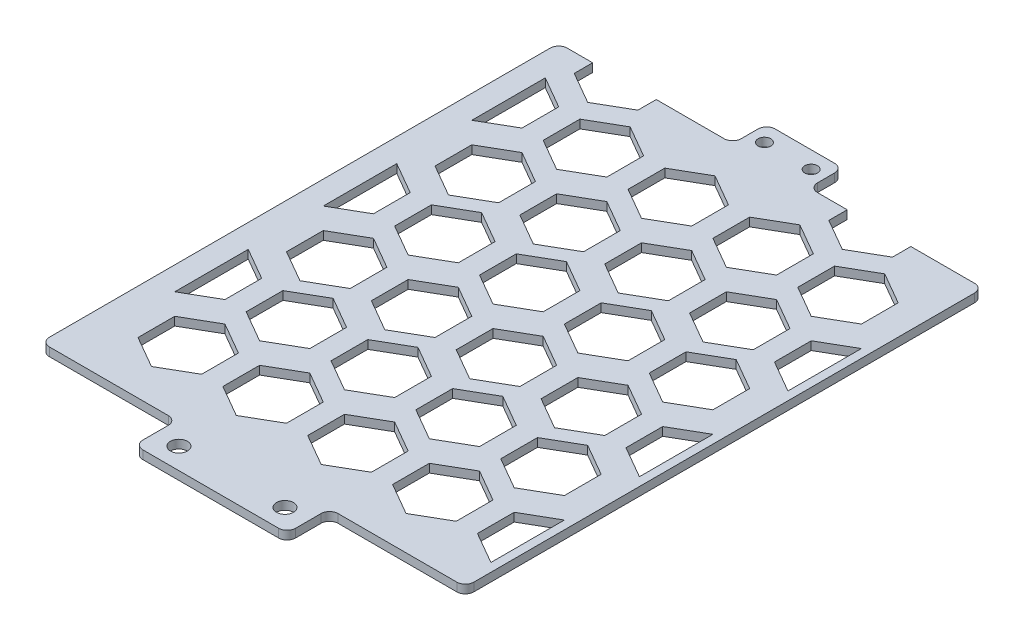
from build123d import *

# Parameters (mm, degrees)
SKETCH_1_R          = 1.5
SKETCH_1_R_2        = 2
EXTRUDE_1_DEPTH     = 2
SKETCH_4_R          = 1.5
CUT_EXTRUDE_3_DEPTH = 10
CUT_EXTRUDE_4_DEPTH = 3
CUT_EXTRUDE_5_DEPTH = 3
FILLET_3_R          = 2


with BuildPart() as part:
    # 草图1 → 凸台-拉伸1 (new body)
    with BuildSketch(Plane(origin=(0, 0, 0), x_dir=(1, 0, 0), z_dir=(0, 1, 0))):
        Polygon((50, -70), (18, -70), (18, -80), (-18, -80), (-18, -70), (-50, -70), (-50, 70), (50, 70), align=None)
        with Locations(Location((-42.5, 66, 0), (0, 0, 270))):
            Circle(SKETCH_1_R, mode=Mode.SUBTRACT)
        with Locations(Location((42.5, 66, 0), (0, 0, 270))):
            Circle(SKETCH_1_R, mode=Mode.SUBTRACT)
        with Locations(Location((-12.5, -75, 0), (0, 0, 270))):
            Circle(SKETCH_1_R_2, mode=Mode.SUBTRACT)
        with Locations(Location((12.5, -75, 0), (0, 0, 270))):
            Circle(SKETCH_1_R_2, mode=Mode.SUBTRACT)
    extrude(amount=EXTRUDE_1_DEPTH)

    # 草图4 → 切除-拉伸3 (cut)
    with BuildSketch(Plane(origin=(0, 2, 0), x_dir=(1, 0, 0), z_dir=(0, 1, 0))):
        with Locations(Location((-5.5, 56, 0), (0, 0, 270))):
            Circle(SKETCH_4_R)
        with Locations(Location((5.5, 56, 0), (0, 0, 270))):
            Circle(SKETCH_4_R)
        Polygon((-50, 70), (50, 70), (50, 52), (9, 52), (9, 60), (-9, 60), (-9, 52), (-50, 52), align=None)
    extrude(amount=-CUT_EXTRUDE_3_DEPTH, mode=Mode.SUBTRACT)

    # 草图5 → 切除-拉伸4 (cut)
    with BuildSketch(Plane(origin=(0, 2, 0), x_dir=(1, 0, 0), z_dir=(0, 1, 0))):
        Polygon((-34.5, 43.339745962), (-27, 47.669872981), (-27, 56.330127019), (-34.5, 60.660254038), (-42, 56.330127019), (-42, 47.669872981), align=None)
        Polygon((25.5, 43.339745962), (33, 47.669872981), (33, 56.330127019), (25.5, 60.660254038), (18, 56.330127019), (18, 47.669872981), align=None)
    extrude(amount=-CUT_EXTRUDE_4_DEPTH, mode=Mode.SUBTRACT)

    # 草图7 → 切除-拉伸5 (cut)
    with BuildSketch(Plane(origin=(0, 2, 0), x_dir=(1, 0, 0), z_dir=(0, 1, 0))):
        Polygon((-24.5, 43.339745962), (-32, 39.009618943), (-32, 30.349364905), (-24.5, 26.019237886), (-17, 30.349364905), (-17, 39.009618943), align=None)
        Polygon((-12, 8.02885683), (-4.5, 12.358983849), (-4.5, 21.019237886), (-12, 25.349364905), (-19.5, 21.019237886), (-19.5, 12.358983849), align=None)
        Polygon((-32, 25.349364905), (-39.5, 21.019237886), (-39.5, 12.358983849), (-32, 8.02885683), (-24.5, 12.358983849), (-24.5, 21.019237886), align=None)
        Polygon((-12, 30.349364905), (-4.5, 26.019237886), (3, 30.349364905), (3, 39.009618943), (-4.5, 43.339745962), (-12, 39.009618943), align=None)
        Polygon((8, 8.02885683), (15.5, 12.358983849), (15.5, 21.019237886), (8, 25.349364905), (0.5, 21.019237886), (0.5, 12.358983849), align=None)
        Polygon((8, 30.349364905), (15.5, 26.019237886), (23, 30.349364905), (23, 39.009618943), (15.5, 43.339745962), (8, 39.009618943), align=None)
        Polygon((28, 8.02885683), (35.5, 12.358983849), (35.5, 21.019237886), (28, 25.349364905), (20.5, 21.019237886), (20.5, 12.358983849), align=None)
        Polygon((28, 30.349364905), (35.5, 26.019237886), (43, 30.349364905), (43, 39.009618943), (35.5, 43.339745962), (28, 39.009618943), align=None)
        Polygon((48, 25.349364905), (40.5, 21.019237886), (40.5, 12.358983849), (48, 8.02885683), align=None)
        Polygon((-12, -26.97114317), (-4.5, -22.641016151), (-4.5, -13.980762114), (-12, -9.650635095), (-19.5, -13.980762114), (-19.5, -22.641016151), align=None)
        Polygon((-12, -4.650635095), (-4.5, -8.980762114), (3, -4.650635095), (3, 4.009618943), (-4.5, 8.339745962), (-12, 4.009618943), align=None)
        Polygon((8, -26.97114317), (15.5, -22.641016151), (15.5, -13.980762114), (8, -9.650635095), (0.5, -13.980762114), (0.5, -22.641016151), align=None)
        Polygon((8, -4.650635095), (15.5, -8.980762114), (23, -4.650635095), (23, 4.009618943), (15.5, 8.339745962), (8, 4.009618943), align=None)
        Polygon((28, -26.97114317), (35.5, -22.641016151), (35.5, -13.980762114), (28, -9.650635095), (20.5, -13.980762114), (20.5, -22.641016151), align=None)
        Polygon((28, -4.650635095), (35.5, -8.980762114), (43, -4.650635095), (43, 4.009618943), (35.5, 8.339745962), (28, 4.009618943), align=None)
        Polygon((48, -9.650635095), (40.5, -13.980762114), (40.5, -22.641016151), (48, -26.97114317), align=None)
        Polygon((-12, -61.97114317), (-4.5, -57.641016151), (-4.5, -48.980762114), (-12, -44.650635095), (-19.5, -48.980762114), (-19.5, -57.641016151), align=None)
        Polygon((-12, -39.650635095), (-4.5, -43.980762114), (3, -39.650635095), (3, -30.990381057), (-4.5, -26.660254038), (-12, -30.990381057), align=None)
        Polygon((8, -61.97114317), (15.5, -57.641016151), (15.5, -48.980762114), (8, -44.650635095), (0.5, -48.980762114), (0.5, -57.641016151), align=None)
        Polygon((8, -39.650635095), (15.5, -43.980762114), (23, -39.650635095), (23, -30.990381057), (15.5, -26.660254038), (8, -30.990381057), align=None)
        Polygon((28, -61.97114317), (35.5, -57.641016151), (35.5, -48.980762114), (28, -44.650635095), (20.5, -48.980762114), (20.5, -57.641016151), align=None)
        Polygon((28, -39.650635095), (35.5, -43.980762114), (43, -39.650635095), (43, -30.990381057), (35.5, -26.660254038), (28, -30.990381057), align=None)
        Polygon((48, -44.650635095), (40.5, -48.980762114), (40.5, -57.641016151), (48, -61.97114317), align=None)
        Polygon((-32, -26.97114317), (-24.5, -22.641016151), (-24.5, -13.980762114), (-32, -9.650635095), (-39.5, -13.980762114), (-39.5, -22.641016151), align=None)
        Polygon((-32, -4.650635095), (-24.5, -8.980762114), (-17, -4.650635095), (-17, 4.009618943), (-24.5, 8.339745962), (-32, 4.009618943), align=None)
        Polygon((-32, -61.97114317), (-24.5, -57.641016151), (-24.5, -48.980762114), (-32, -44.650635095), (-39.5, -48.980762114), (-39.5, -57.641016151), align=None)
        Polygon((-32, -39.650635095), (-24.5, -43.980762114), (-17, -39.650635095), (-17, -30.990381057), (-24.5, -26.660254038), (-32, -30.990381057), align=None)
        Polygon((-44.5, -43.980762114), (-37, -39.650635095), (-37, -30.990381057), (-44.5, -26.660254038), align=None)
        Polygon((-44.5, -8.980762114), (-37, -4.650635095), (-37, 4.009618943), (-44.5, 8.339745962), align=None)
        Polygon((-44.5, 26.019237886), (-37, 30.349364905), (-37, 39.009618943), (-44.5, 43.339745962), align=None)
    extrude(amount=-CUT_EXTRUDE_5_DEPTH, mode=Mode.SUBTRACT)

    # 圆角3
    fillet_3_edges = [part.edges().sort_by_distance(p)[0] for p in [
        (50, 1, 70),
        (18, 1, 70),
        (18, 1, 80),
        (-18, 1, 80),
        (-18, 1, 70),
        (-50, 1, 70),
        (9, 1, -52),
        (9, 1, -60),
        (-9, 1, -60),
        (-9, 1, -52),
        (50, 1, -52),
        (-50, 1, -52),
    ]]
    fillet(fillet_3_edges, radius=FILLET_3_R)


solid = part.part
